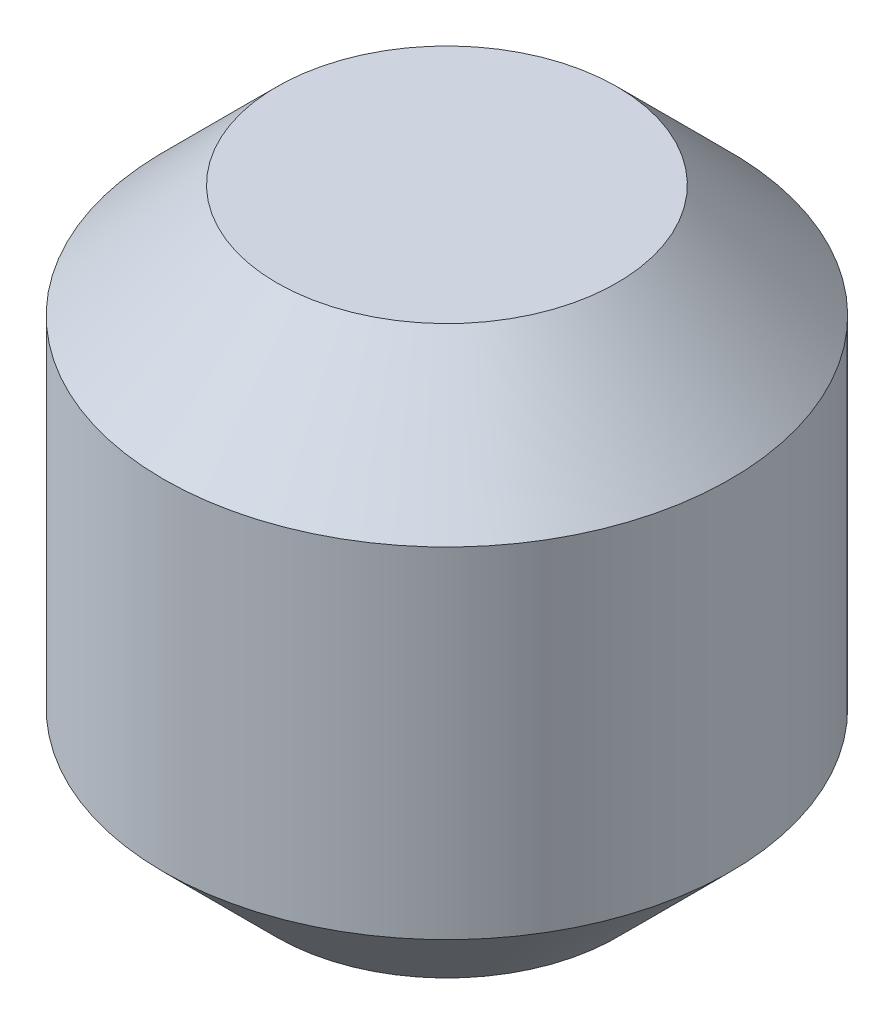
from build123d import *

# Parameters (mm, degrees)
SKETCH1_R           = 25
BOSS_EXTRUDE4_DEPTH = 50
CHAMFER2_SIZE       = 10
CHAMFER3_SIZE       = 10


with BuildPart() as part:
    # Sketch1 → Boss-Extrude4 (new body)
    with BuildSketch(Plane(origin=(0, 0, 0), x_dir=(1, 0, 0), z_dir=(0, 1, 0))):
        with Locations(Location((18.986456029, -23.441436424, 0), (0, 0, 270))):
            Circle(SKETCH1_R)
    extrude(amount=BOSS_EXTRUDE4_DEPTH)

    # Chamfer2
    chamfer2_edges = [part.edges().sort_by_distance(p)[0] for p in [
        (18.986456029, 50, -1.558563576),
    ]]
    chamfer(chamfer2_edges, length=CHAMFER2_SIZE)

    # Chamfer3
    chamfer3_edges = [part.edges().sort_by_distance(p)[0] for p in [
        (18.986456029, 0, -1.558563576),
    ]]
    chamfer(chamfer3_edges, length=CHAMFER3_SIZE)


solid = part.part
